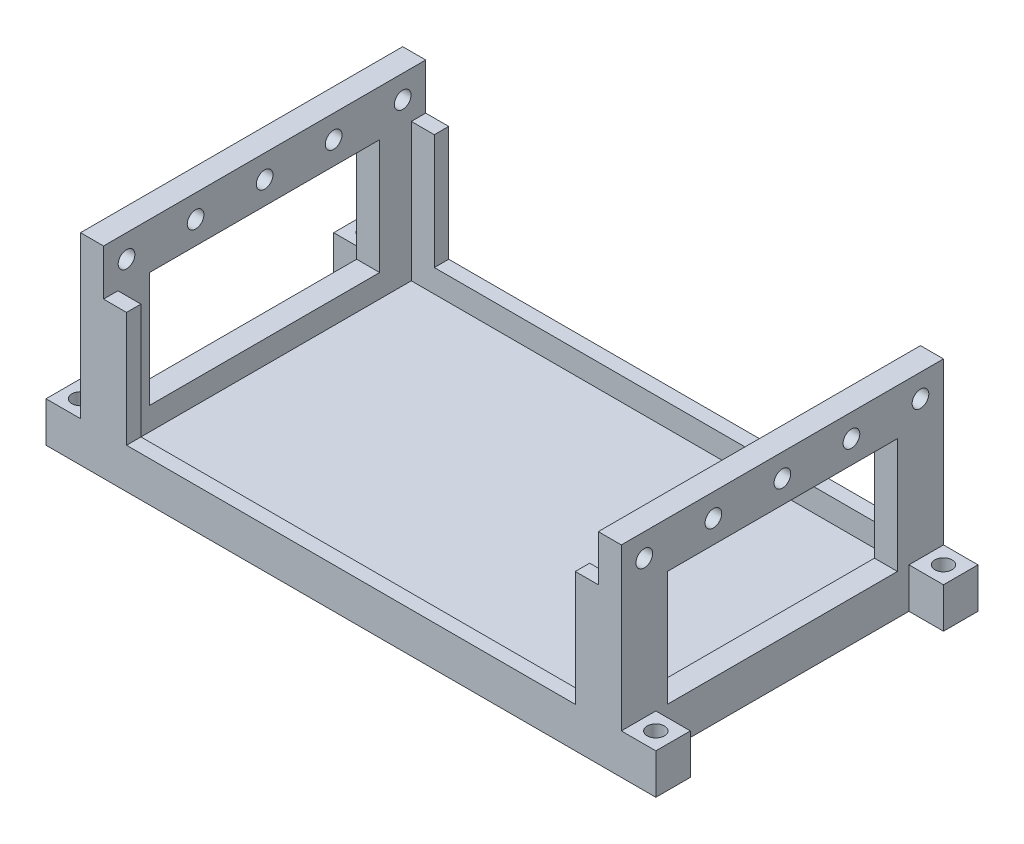
from build123d import *

# Parameters (mm, degrees)
SKETCH1_R           = 1.5
BOSS_EXTRUDE1_DEPTH = 3
SKETCH2_R           = 1.5
SKETCH2_W           = 86
SKETCH2_H           = 51
BOSS_EXTRUDE2_DEPTH = 4
BOSS_EXTRUDE3_DEPTH = 20
SKETCH4_W           = 4
SKETCH4_H           = 56
BOSS_EXTRUDE4_DEPTH = 8
SKETCH5_R           = 1.45
CUT_EXTRUDE1_DEPTH  = 120.837389825


with BuildPart() as part:
    # Sketch1 → Boss-Extrude1 (new body)
    with BuildSketch(Plane(origin=(0, 0, 0), x_dir=(1, 0, 0), z_dir=(0, 1, 0))):
        Polygon((0, 0), (94, 0), (100, 0), (100, 6), (94, 6), (94, 50), (100, 50), (100, 56), (94, 56), (0, 56), (-6, 56), (-6, 50), (0, 50), (0, 6), (-6, 6), (-6, 0), align=None)
        with Locations(Location((-3, 53, 0), (0, 0, 270))):
            Circle(SKETCH1_R, mode=Mode.SUBTRACT)
        with Locations(Location((97, 53, 0), (0, 0, 90))):
            Circle(SKETCH1_R, mode=Mode.SUBTRACT)
        with Locations(Location((97, 3, 0), (0, 0, 270))):
            Circle(SKETCH1_R, mode=Mode.SUBTRACT)
        with Locations(Location((-3, 3, 0), (0, 0, 90))):
            Circle(SKETCH1_R, mode=Mode.SUBTRACT)
    extrude(amount=BOSS_EXTRUDE1_DEPTH)

    # Sketch2 → Boss-Extrude2 (add)
    with BuildSketch(Plane(origin=(0, 3, 0), x_dir=(1, 0, 0), z_dir=(0, 1, 0))):
        Polygon((0, 50), (0, 6), (-6, 6), (-6, 0), (100, 0), (100, 6), (94, 6), (94, 50), (100, 50), (100, 56), (-6, 56), (-6, 50), align=None)
        with Locations(Location((-3, 53, 0), (0, 0, 270))):
            Circle(SKETCH2_R, mode=Mode.SUBTRACT)
        with Locations(Location((97, 53, 0), (0, 0, 90))):
            Circle(SKETCH2_R, mode=Mode.SUBTRACT)
        with Locations(Location((97, 3, 0), (0, 0, 270))):
            Circle(SKETCH2_R, mode=Mode.SUBTRACT)
        with Locations(Location((-3, 3, 0), (0, 0, 90))):
            Circle(SKETCH2_R, mode=Mode.SUBTRACT)
        with Locations((47, 28)):
            Rectangle(SKETCH2_W, SKETCH2_H, mode=Mode.SUBTRACT)
    extrude(amount=BOSS_EXTRUDE2_DEPTH)

    # Sketch3 → Boss-Extrude3 (add)
    with BuildSketch(Plane(origin=(0, 7, 0), x_dir=(1, 0, 0), z_dir=(0, 1, 0))):
        Polygon((8, 56), (0, 56), (0, 48), (4, 48), (4, 53.5), (8, 53.5), align=None)
        Polygon((90, 48), (94, 48), (94, 56), (86, 56), (86, 53.5), (90, 53.5), align=None)
        Polygon((94, 0), (94, 8), (90, 8), (90, 2.5), (86, 2.5), (86, 0), align=None)
        Polygon((4, 8), (0, 8), (0, 0), (8, 0), (8, 2.5), (4, 2.5), align=None)
    extrude(amount=BOSS_EXTRUDE3_DEPTH)

    # Sketch4 → Boss-Extrude4 (add)
    with BuildSketch(Plane(origin=(0, 27, 0), x_dir=(1, 0, 0), z_dir=(0, 1, 0))):
        with Locations((2, 28)):
            Rectangle(SKETCH4_W, SKETCH4_H)
        with Locations((92, 28)):
            Rectangle(SKETCH4_W, SKETCH4_H)
    extrude(amount=BOSS_EXTRUDE4_DEPTH)

    # Sketch5 → Cut-Extrude1 (cut, through all)
    with BuildSketch(Plane.ZY):
        with Locations((-52, 31)):
            Circle(SKETCH5_R)
        with Locations((-40, 31)):
            Circle(SKETCH5_R)
        with Locations((-28, 31)):
            Circle(SKETCH5_R)
        with Locations((-16, 31)):
            Circle(SKETCH5_R)
        with Locations((-4, 31)):
            Circle(SKETCH5_R)
    extrude(amount=-CUT_EXTRUDE1_DEPTH, mode=Mode.SUBTRACT)


solid = part.part
